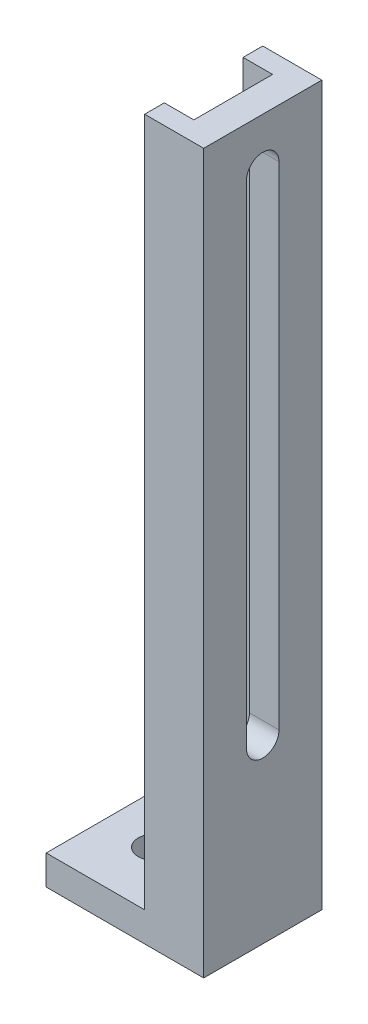
from build123d import *

# Parameters (mm, degrees)
SKETCH_1_W          = 6
SKETCH_1_H          = 12
EXTRUDE_1_DEPTH     = 70
SKETCH_2_W          = 16
SKETCH_2_H          = 12
EXTRUDE_2_DEPTH     = 3
SKETCH_3_R          = 1.65
CUT_EXTRUDE_1_DEPTH = 3
SKETCH_4_W          = 8
SKETCH_4_H          = 60
CUT_EXTRUDE_2_DEPTH = 3
CUT_EXTRUDE_3_DEPTH = 3


with BuildPart() as part:
    # 草图1 → 凸台-拉伸1 (new body)
    with BuildSketch(Plane(origin=(0, 0, 0), x_dir=(1, 0, 0), z_dir=(0, 1, 0))):
        Rectangle(SKETCH_1_W, SKETCH_1_H)
    extrude(amount=EXTRUDE_1_DEPTH)

    # 草图2 → 凸台-拉伸2 (add)
    with BuildSketch(Plane(origin=(0, 0, 0), x_dir=(1, 0, 0), z_dir=(0, 1, 0))):
        with Locations((-5, 0)):
            Rectangle(SKETCH_2_W, SKETCH_2_H)
    extrude(amount=-EXTRUDE_2_DEPTH)

    # 草图3 → 切除-拉伸1 (cut)
    with BuildSketch(Plane(origin=(0, 0, 0), x_dir=(1, 0, 0), z_dir=(0, 1, 0))):
        with Locations(Location((-8, 0, 0), (0, 0, 270))):
            Circle(SKETCH_3_R)
    extrude(amount=-CUT_EXTRUDE_1_DEPTH, mode=Mode.SUBTRACT)

    # 草图4 → 切除-拉伸2 (cut)
    with BuildSketch(Plane(origin=(-3, 0, 0), x_dir=(0, 0, -1), z_dir=(1, 0, 0))):
        with Locations((0, 40)):
            Rectangle(SKETCH_4_W, SKETCH_4_H)
    extrude(amount=CUT_EXTRUDE_2_DEPTH, mode=Mode.SUBTRACT)

    # 草图5 → 切除-拉伸3 (cut)
    with BuildSketch(Plane.ZY):
        with BuildLine():
            Line((1.65, 65), (1.65, 15))
            ThreePointArc((1.65, 15), (0, 13.35), (-1.65, 15))
            Line((-1.65, 15), (-1.65, 65))
            ThreePointArc((-1.65, 65), (0, 66.65), (1.65, 65))
        make_face()
    extrude(amount=-CUT_EXTRUDE_3_DEPTH, mode=Mode.SUBTRACT)


solid = part.part
